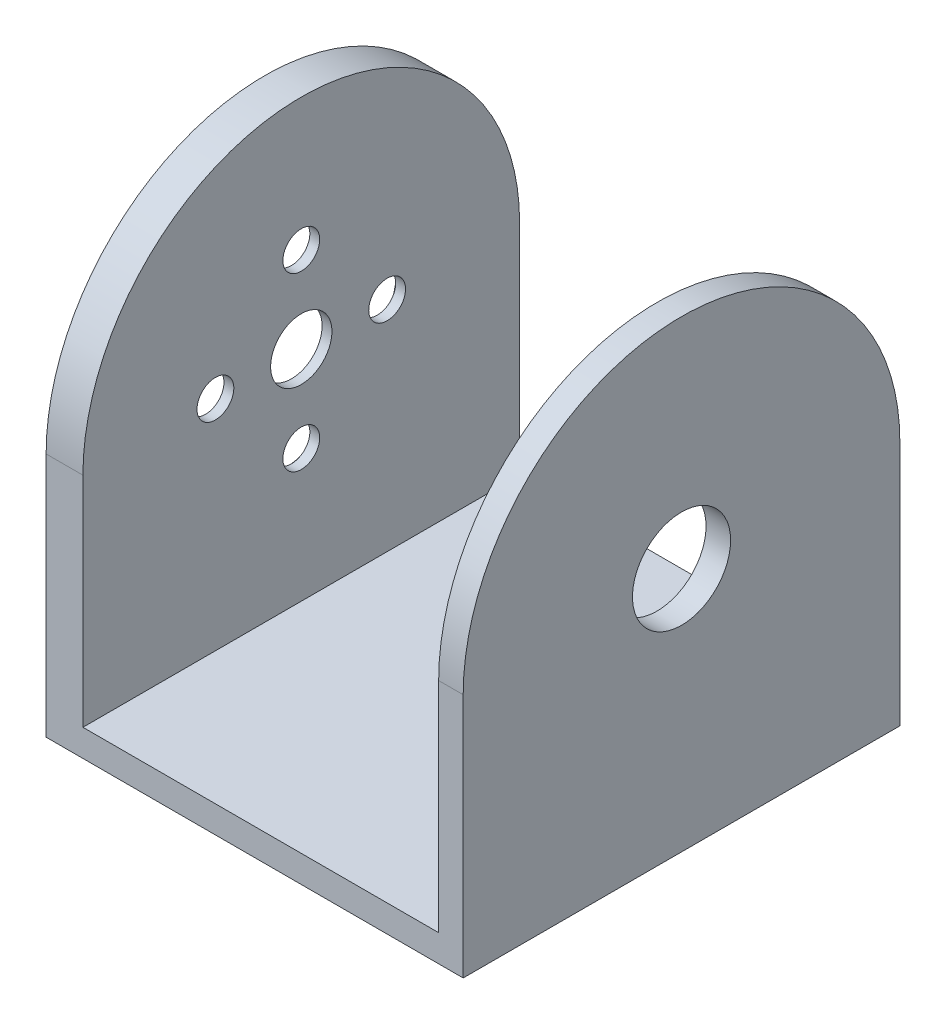
from build123d import *

# Parameters (mm, degrees)
SKETCH1_W           = 34
SKETCH1_H           = 35.6
BOSS_EXTRUDE1_DEPTH = 2.2
BOSS_EXTRUDE2_DEPTH = 3
BOSS_EXTRUDE3_START = -32
BOSS_EXTRUDE3_DEPTH = 2
SKETCH4_R           = 2.5
SKETCH4_R_2         = 1.5
CUT_EXTRUDE1_DEPTH  = 12
SKETCH4_3_R         = 10.925
SKETCH4_3_R_2       = 1.5
SKETCH4_3_R_3       = 2.5
CUT_EXTRUDE2_DEPTH  = 2.2
SKETCH5_R           = 4
CUT_EXTRUDE3_DEPTH  = 12.2


with BuildPart() as part:
    # Sketch1 → Boss-Extrude1 (new body)
    with BuildSketch(Plane(origin=(0, 0, 0), x_dir=(1, 0, 0), z_dir=(0, 1, 0))):
        Rectangle(SKETCH1_W, SKETCH1_H)
    extrude(amount=BOSS_EXTRUDE1_DEPTH)

    # Sketch3 → Boss-Extrude2 (add)
    with BuildSketch(Plane.ZY.offset(17)):
        with BuildLine():
            Line((0, 37.8), (0, 2.2))
            Line((0, 2.2), (17.8, 2.2))
            Line((17.8, 2.2), (17.8, 20))
            ThreePointArc((17.8, 20), (12.586500705, 32.586500705), (0, 37.8))
        make_face()
        with BuildLine():
            Line((-17.8, 2.2), (0, 2.2))
            Line((0, 2.2), (0, 37.8))
            ThreePointArc((0, 37.8), (-12.586500705, 32.586500705), (-17.8, 20))
            Line((-17.8, 20), (-17.8, 2.2))
        make_face()
    extrude(amount=-BOSS_EXTRUDE2_DEPTH)

    # Sketch3<4> → Boss-Extrude3 (add)
    with BuildSketch(Plane.ZY.offset(17).offset(BOSS_EXTRUDE3_START)):
        with BuildLine():
            Line((-17.8, 2.2), (0, 2.2))
            Line((0, 2.2), (0, 37.8))
            ThreePointArc((0, 37.8), (-12.586500705, 32.586500705), (-17.8, 20))
            Line((-17.8, 20), (-17.8, 2.2))
        make_face()
        with BuildLine():
            Line((0, 37.8), (0, 2.2))
            Line((0, 2.2), (17.8, 2.2))
            Line((17.8, 2.2), (17.8, 20))
            ThreePointArc((17.8, 20), (12.586500705, 32.586500705), (0, 37.8))
        make_face()
    extrude(amount=-BOSS_EXTRUDE3_DEPTH)

    # Sketch4 → Cut-Extrude1 (cut)
    with BuildSketch(Plane.ZY.offset(17)):
        with Locations((0, 20)):
            Circle(SKETCH4_R)
        with Locations((7, 20)):
            Circle(SKETCH4_R_2)
        with Locations((0, 27)):
            Circle(SKETCH4_R_2)
        with Locations((-7, 20)):
            Circle(SKETCH4_R_2)
        with Locations((0, 13)):
            Circle(SKETCH4_R_2)
    extrude(amount=-CUT_EXTRUDE1_DEPTH, mode=Mode.SUBTRACT)

    # Sketch4<3> → Cut-Extrude2 (cut)
    with BuildSketch(Plane.ZY.offset(17)):
        with Locations((0, 20)):
            Circle(SKETCH4_3_R)
        with Locations((0, 27)):
            Circle(SKETCH4_3_R_2, mode=Mode.SUBTRACT)
        with Locations((0, 13)):
            Circle(SKETCH4_3_R_2, mode=Mode.SUBTRACT)
        with Locations((-7, 20)):
            Circle(SKETCH4_3_R_2, mode=Mode.SUBTRACT)
        with Locations((7, 20)):
            Circle(SKETCH4_3_R_2, mode=Mode.SUBTRACT)
        with Locations((0, 20)):
            Circle(SKETCH4_3_R_3, mode=Mode.SUBTRACT)
    extrude(amount=-CUT_EXTRUDE2_DEPTH, mode=Mode.SUBTRACT)

    # Sketch5 → Cut-Extrude3 (cut)
    with BuildSketch(Plane(origin=(17, 0, 0), x_dir=(0, 0, -1), z_dir=(1, 0, 0))):
        with Locations((0, 20)):
            Circle(SKETCH5_R)
    extrude(amount=-CUT_EXTRUDE3_DEPTH, mode=Mode.SUBTRACT)


solid = part.part
